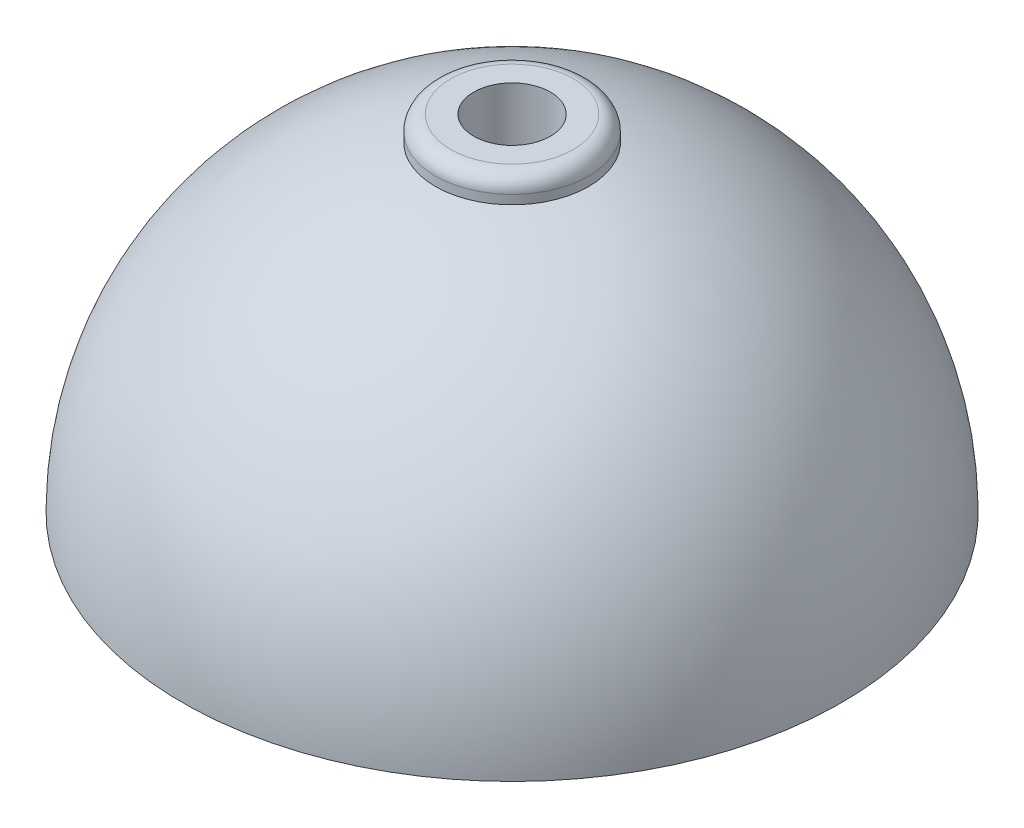
from build123d import *

# Parameters (mm, degrees)
SHELL1_T                 = -2
BOSS_EXTRUDE6_DEPTH      = 1
BOSS_EXTRUDE6_DEPTH_BACK = 15
SKETCH4_R                = 5
SKETCH2_R                = 2.5
CUT_EXTRUDE3_DEPTH       = 38.825256113
FILLET1_R                = 1


with BuildPart() as part:
    # Sketch1 → Revolve1 (revolve)
    with BuildSketch(Plane.XY):
        with BuildLine():
            Line((0, 0), (21.5, 0))
            ThreePointArc((21.5, 0), (15.202795796, 15.202795796), (0, 21.5))
            Line((0, 21.5), (0, 0))
        make_face()
    revolve(axis=Axis((0, 0, 0), (0, 1, 0)))

    # Shell1
    shell1_openings = [part.faces().sort_by_distance(p)[0] for p in [
        (0, 0, 0),
    ]]
    offset(amount=SHELL1_T, openings=shell1_openings, kind=Kind.INTERSECTION)

    # Sketch4 → Boss-Extrude6 (add, two sides: drawn at the far end of the back side and taken through both)
    with BuildSketch(Plane(origin=(0, 21.5, 0), x_dir=(1, 0, 0), z_dir=(0, 1, 0)).offset(-BOSS_EXTRUDE6_DEPTH_BACK)):
        with Locations(Location((0, 0, 0), (0, 0, 270))):
            Circle(SKETCH4_R)
    extrude(amount=BOSS_EXTRUDE6_DEPTH + BOSS_EXTRUDE6_DEPTH_BACK)

    # Sketch2 → Cut-Extrude3 (cut, through all)
    with BuildSketch(Plane(origin=(0, 0, 0), x_dir=(1, 0, 0), z_dir=(0, 1, 0))):
        with Locations(Location((0, 0, 0), (0, 0, 90))):
            Circle(SKETCH2_R)
    extrude(amount=CUT_EXTRUDE3_DEPTH, mode=Mode.SUBTRACT)

    # Fillet1
    fillet1_edges = [part.edges().sort_by_distance(p)[0] for p in [
        (0, 22.5, -5),
    ]]
    fillet(fillet1_edges, radius=FILLET1_R)


solid = part.part
